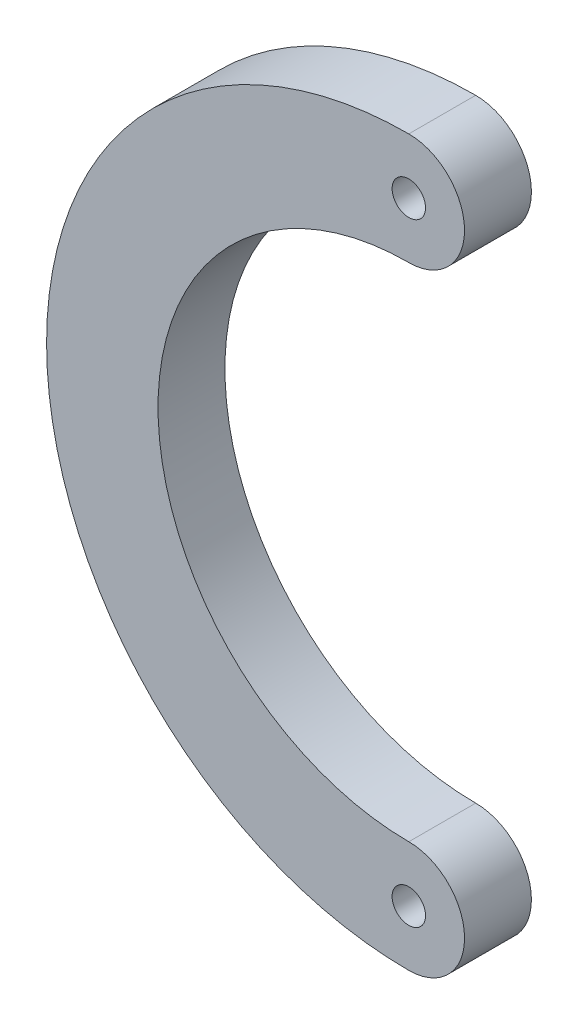
from build123d import *

# Parameters (mm, degrees)
BOSS_EXTRUDE1_DEPTH   = 6
F_3_0MM_DOWEL_HOLE1_D = 3


with BuildPart() as part:
    # Sketch1 → Boss-Extrude1 (new body)
    with BuildSketch(Plane.XY):
        with BuildLine():
            ThreePointArc((0, 32.5), (-32.5, 0), (0, -32.5))
            ThreePointArc((0, -32.5), (5, -27.5), (0, -22.5))
            ThreePointArc((0, -22.5), (-22.5, 0), (0, 22.5))
            ThreePointArc((0, 22.5), (5, 27.5), (0, 32.5))
        make_face()
    extrude(amount=BOSS_EXTRUDE1_DEPTH)

    # Ø3.0mm Dowel Hole1 (through all)
    with Locations(Plane.XY.offset(6)):
        with Locations((0, 27.5), (0, -27.5)):
            Hole(F_3_0MM_DOWEL_HOLE1_D / 2)


solid = part.part
